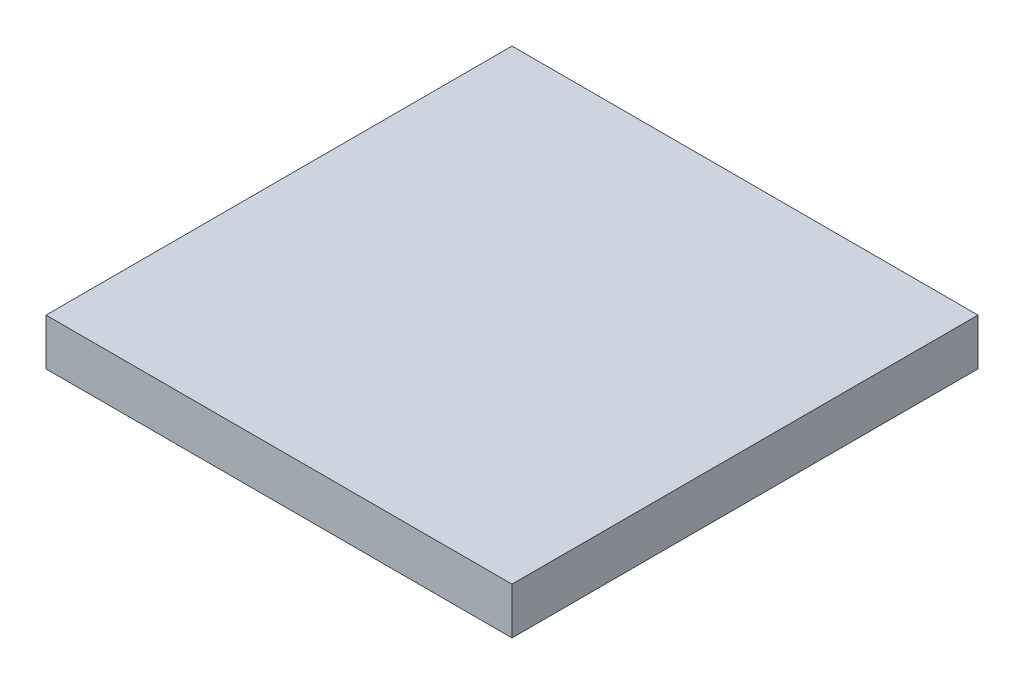
from build123d import *

# Parameters (mm, degrees)
SKETCH_1_W      = 20
SKETCH_1_H      = 20
EXTRUDE_1_DEPTH = 2


with BuildPart() as part:
    # 草图1 → 凸台-拉伸1 (new body)
    with BuildSketch(Plane(origin=(0, 0, 0), x_dir=(1, 0, 0), z_dir=(0, 1, 0))):
        Rectangle(SKETCH_1_W, SKETCH_1_H)
    extrude(amount=EXTRUDE_1_DEPTH)


solid = part.part
